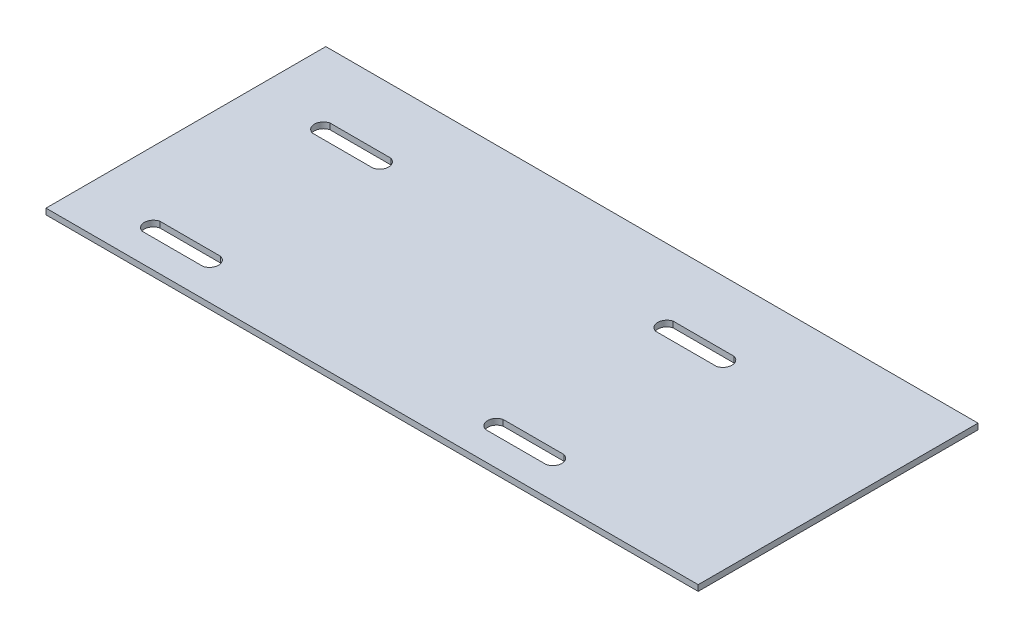
from build123d import *

# Parameters (mm, degrees)
SKETCH1_W           = 303
SKETCH1_H           = 130
BOSS_EXTRUDE1_DEPTH = 2.73


with BuildPart() as part:
    # Sketch1 → Boss-Extrude1 (new body)
    with BuildSketch(Plane(origin=(0, 0, 0), x_dir=(1, 0, 0), z_dir=(0, 1, 0))):
        with Locations((151.5, 20.018589385)):
            Rectangle(SKETCH1_W, SKETCH1_H)
        with BuildLine():
            Line((31.667883176, -31.951410615), (59.962116824, -31.951410615))
            ThreePointArc((59.962116824, -31.951410615), (63.07, -27.876410615), (59.962116824, -23.801410615))
            Line((59.962116824, -23.801410615), (31.667883176, -23.801410615))
            ThreePointArc((31.667883176, -23.801410615), (28.56, -27.876410615), (31.667883176, -31.951410615))
        make_face(mode=Mode.SUBTRACT)
        with BuildLine():
            Line((191.162705572, 55.23720125), (219.45693922, 55.23720125))
            ThreePointArc((219.45693922, 55.23720125), (222.564822396, 51.16220125), (219.45693922, 47.08720125))
            Line((219.45693922, 47.08720125), (191.162705572, 47.08720125))
            ThreePointArc((191.162705572, 47.08720125), (188.054822396, 51.16220125), (191.162705572, 55.23720125))
        make_face(mode=Mode.SUBTRACT)
        with BuildLine():
            Line((31.667883176, 47.08720125), (59.962116824, 47.08720125))
            ThreePointArc((59.962116824, 47.08720125), (63.07, 51.16220125), (59.962116824, 55.23720125))
            Line((59.962116824, 55.23720125), (31.667883176, 55.23720125))
            ThreePointArc((31.667883176, 55.23720125), (28.56, 51.16220125), (31.667883176, 47.08720125))
        make_face(mode=Mode.SUBTRACT)
        with BuildLine():
            Line((191.162705572, -31.951410615), (219.45693922, -31.951410615))
            ThreePointArc((219.45693922, -31.951410615), (222.564822396, -27.876410615), (219.45693922, -23.801410615))
            Line((219.45693922, -23.801410615), (191.162705572, -23.801410615))
            ThreePointArc((191.162705572, -23.801410615), (188.054822396, -27.876410615), (191.162705572, -31.951410615))
        make_face(mode=Mode.SUBTRACT)
    extrude(amount=BOSS_EXTRUDE1_DEPTH)


solid = part.part
